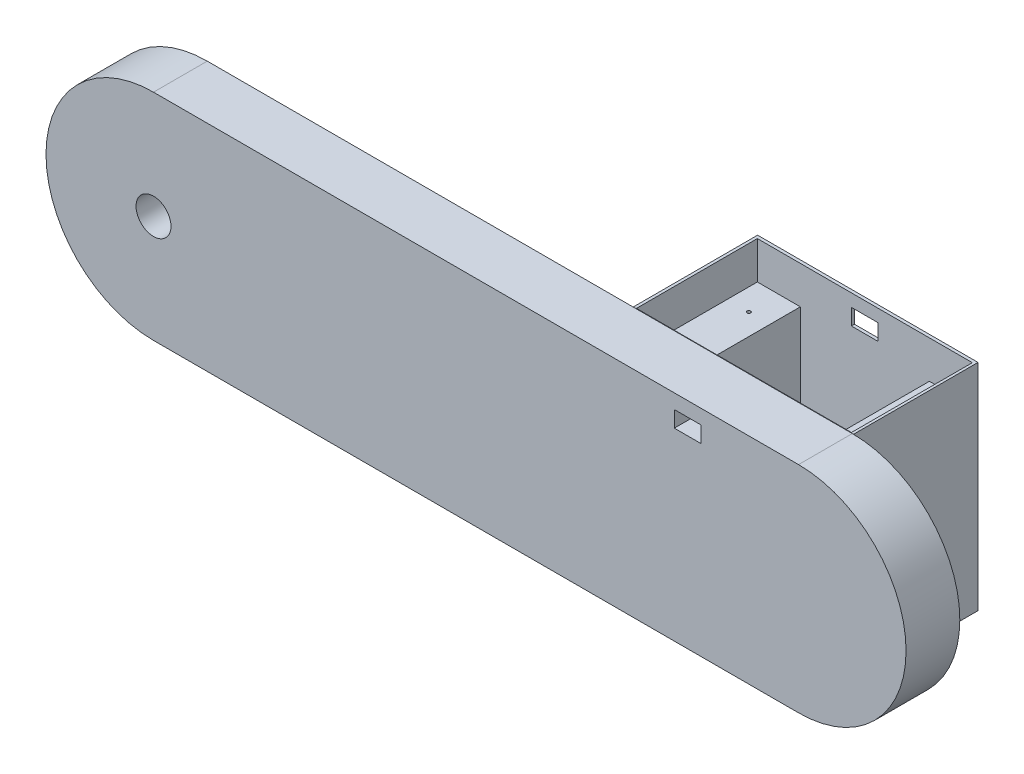
from build123d import *

# Parameters (mm, degrees)
BOSS_EXTRUDE1_DEPTH = 10
SKETCH2_R           = 3.25
CUT_EXTRUDE1_DEPTH  = 6
SKETCH3_W           = 41
SKETCH3_H           = 40
BOSS_EXTRUDE2_DEPTH = 23.5
SKETCH6_W           = 40
SKETCH6_H           = 22.5
CUT_EXTRUDE3_DEPTH  = 39
SKETCH7_W           = 8
SKETCH7_H           = 22.5
BOSS_EXTRUDE3_DEPTH = 32
SKETCH8_R           = 0.325
CUT_EXTRUDE4_DEPTH  = 6
SKETCH9_W           = 4.992378119
SKETCH9_H           = 3.003564519
CUT_EXTRUDE5_DEPTH  = 55


with BuildPart() as part:
    # Sketch1 → Boss-Extrude1 (new body)
    with BuildSketch(Plane.XY):
        with BuildLine():
            Line((-69.937444572, 18.545911552), (50.062555428, 18.545911552))
            ThreePointArc((50.062555428, 18.545911552), (70.062555428, -1.454088448), (50.062555428, -21.454088448))
            Line((50.062555428, -21.454088448), (-69.937444572, -21.454088448))
            ThreePointArc((-69.937444572, -21.454088448), (-89.937444572, -1.454088448), (-69.937444572, 18.545911552))
        make_face()
    extrude(amount=BOSS_EXTRUDE1_DEPTH)

    # Sketch2 → Cut-Extrude1 (cut)
    with BuildSketch(Plane.XY.offset(10)):
        with Locations((-69.937444572, -1.454088448)):
            Circle(SKETCH2_R)
    extrude(amount=-CUT_EXTRUDE1_DEPTH, mode=Mode.SUBTRACT)

    # Sketch3 → Boss-Extrude2 (add)
    with BuildSketch(Plane(origin=(0, 0, 0), x_dir=(-1, 0, 0), z_dir=(0, 0, -1))):
        with Locations((-29.444527942, -1.79966235)):
            Rectangle(SKETCH3_W, SKETCH3_H)
    extrude(amount=BOSS_EXTRUDE2_DEPTH)

    # Sketch6 → Cut-Extrude3 (cut)
    with BuildSketch(Plane(origin=(0, 18.20033765, 0), x_dir=(1, 0, 0), z_dir=(0, 1, 0))):
        with Locations((29.465316663, 11.681829122)):
            Rectangle(SKETCH6_W, SKETCH6_H)
    extrude(amount=-CUT_EXTRUDE3_DEPTH, mode=Mode.SUBTRACT)

    # Sketch7 → Boss-Extrude3 (add)
    with BuildSketch(Plane(origin=(0, -20.79966235, 0), x_dir=(1, 0, 0), z_dir=(0, 1, 0))):
        with Locations((13.465316663, 11.681829122)):
            Rectangle(SKETCH7_W, SKETCH7_H)
        with Locations((45.465316663, 11.681829122)):
            Rectangle(SKETCH7_W, SKETCH7_H)
    extrude(amount=BOSS_EXTRUDE3_DEPTH)

    # Sketch8 → Cut-Extrude4 (cut)
    with BuildSketch(Plane(origin=(0, 11.20033765, 0), x_dir=(1, 0, 0), z_dir=(0, 1, 0))):
        with Locations(Location((45.488062991, 17.306829122, 0), (0, 0, 270))):
            Circle(SKETCH8_R)
        with Locations(Location((45.488062991, 6.056829122, 0), (0, 0, 270))):
            Circle(SKETCH8_R)
        with Locations(Location((13.505340173, 17.306829122, 0), (0, 0, 270))):
            Circle(SKETCH8_R)
        with Locations(Location((13.505340173, 6.056829122, 0), (0, 0, 270))):
            Circle(SKETCH8_R)
    extrude(amount=-CUT_EXTRUDE4_DEPTH, mode=Mode.SUBTRACT)

    # Sketch9 → Cut-Extrude5 (cut)
    with BuildSketch(Plane(origin=(0, 0, -23.5), x_dir=(-1, 0, 0), z_dir=(0, 0, -1))):
        with Locations((-29.444527942, 14.360774469)):
            Rectangle(SKETCH9_W, SKETCH9_H)
    extrude(amount=-CUT_EXTRUDE5_DEPTH, mode=Mode.SUBTRACT)


solid = part.part
